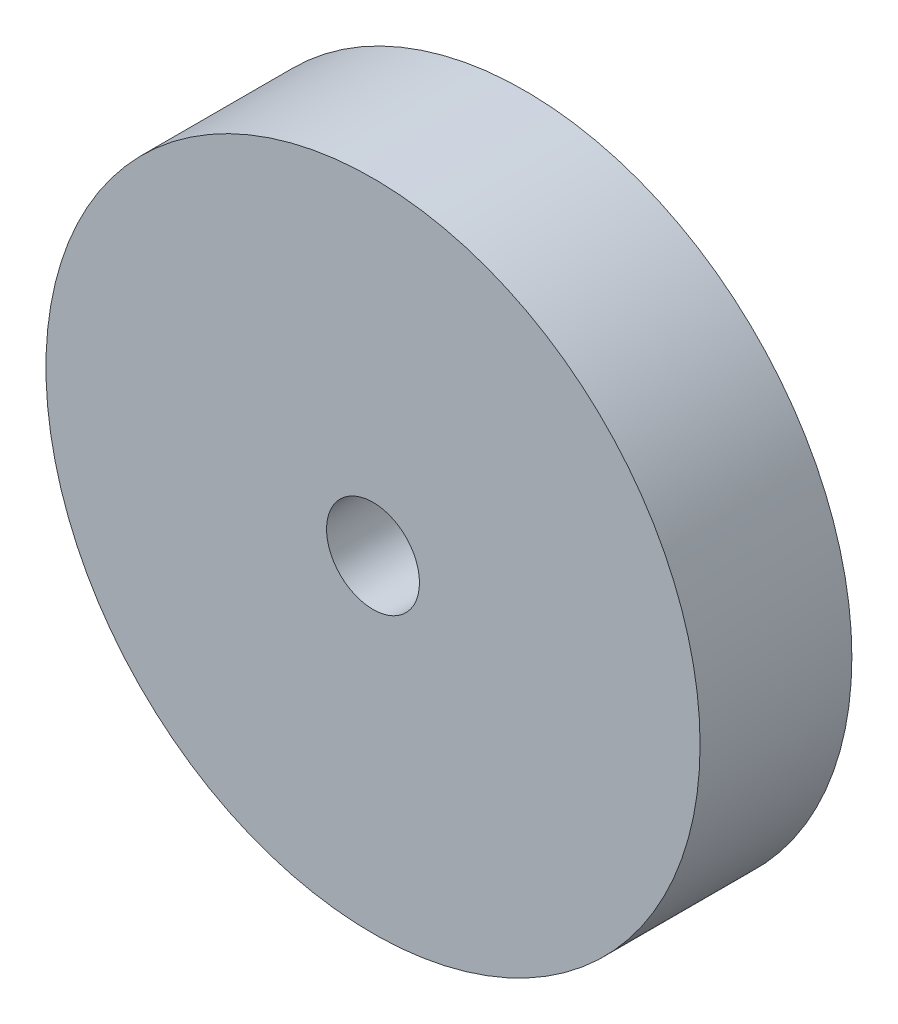
from build123d import *

# Parameters (mm, degrees)
SKETCH1_R          = 21.55
BASE_DEPTH         = 10
SKETCH2_R          = 3.06
CUT_EXTRUDE1_DEPTH = 33.074990257


with BuildPart() as part:
    # Sketch1 → Base (new body)
    with BuildSketch(Plane.XY):
        Circle(SKETCH1_R)
    extrude(amount=BASE_DEPTH)

    # Sketch2 → Cut-Extrude1 (cut, through all)
    with BuildSketch(Plane.XY.offset(10)):
        Circle(SKETCH2_R)
    extrude(amount=-CUT_EXTRUDE1_DEPTH, mode=Mode.SUBTRACT)


solid = part.part
